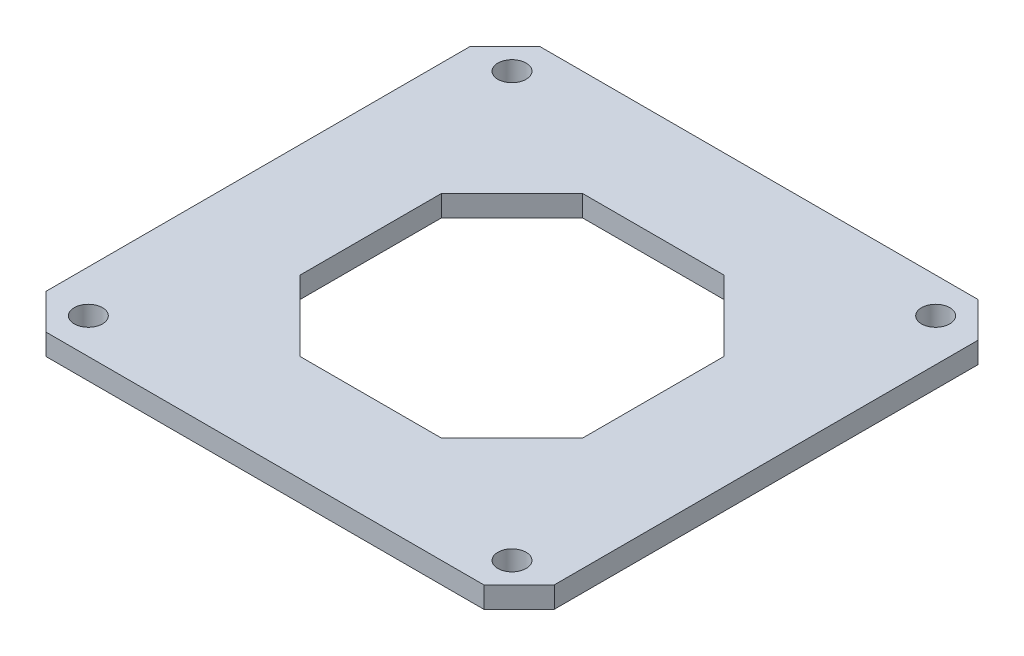
from build123d import *

# Parameters (mm, degrees)
SKETCH_1_W      = 72
SKETCH_1_H      = 70
SKETCH_1_R      = 2
SKETCH_1_W_2    = 40
SKETCH_1_H_2    = 40
EXTRUDE_1_DEPTH = 3
CHAMFER_1_SIZE  = 10
CHAMFER_2_SIZE  = 5


with BuildPart() as part:
    # 草图1 → 凸台-拉伸1 (new body)
    with BuildSketch(Plane(origin=(0, 0, 0), x_dir=(1, 0, 0), z_dir=(0, 1, 0))):
        Rectangle(SKETCH_1_W, SKETCH_1_H)
        with Locations(Location((-30, 30, 0), (0, 0, 270))):
            Circle(SKETCH_1_R, mode=Mode.SUBTRACT)
        with Locations(Location((30, 30, 0), (0, 0, 270))):
            Circle(SKETCH_1_R, mode=Mode.SUBTRACT)
        with Locations(Location((30, -30, 0), (0, 0, 270))):
            Circle(SKETCH_1_R, mode=Mode.SUBTRACT)
        with Locations(Location((-30, -30, 0), (0, 0, 270))):
            Circle(SKETCH_1_R, mode=Mode.SUBTRACT)
        Rectangle(SKETCH_1_W_2, SKETCH_1_H_2, mode=Mode.SUBTRACT)
    extrude(amount=EXTRUDE_1_DEPTH)

    # 倒角1
    chamfer_1_edges = [part.edges().sort_by_distance(p)[0] for p in [
        (20, 1.5, -20),
        (-20, 1.5, -20),
        (-20, 1.5, 20),
        (20, 1.5, 20),
    ]]
    chamfer(chamfer_1_edges, length=CHAMFER_1_SIZE)

    # 倒角2
    chamfer_2_edges = [part.edges().sort_by_distance(p)[0] for p in [
        (-36, 1.5, 35),
        (-36, 1.5, -35),
        (36, 1.5, -35),
        (36, 1.5, 35),
    ]]
    chamfer(chamfer_2_edges, length=CHAMFER_2_SIZE)


solid = part.part
